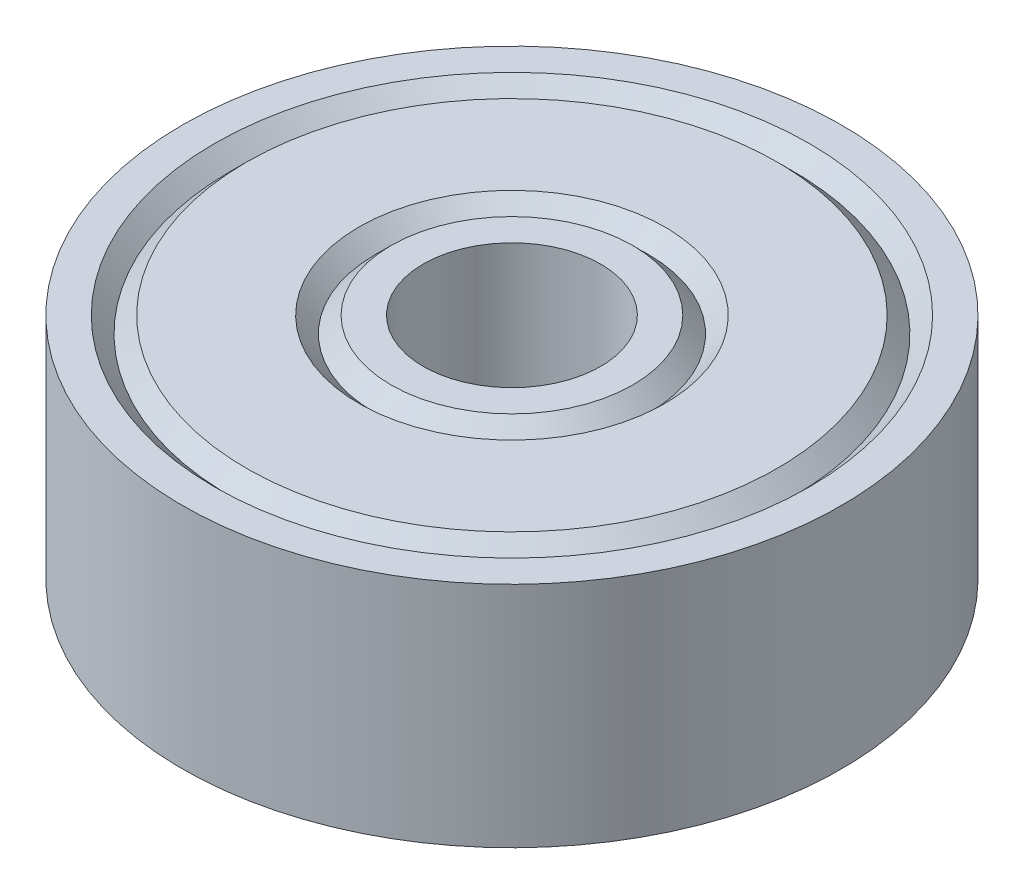
from build123d import *


with BuildPart() as part:
    # Sketch1 → Revolve1 (revolve)
    with BuildSketch(Plane.XY):
        Polygon((-3.5, 4.5), (-4.766666667, 4.5), (-5.4, 3.866666667), (-6.033333333, 4.5), (-10.466666667, 4.5), (-11.1, 3.866666667), (-11.733333333, 4.5), (-13, 4.5), (-13, -4.5), (-11.733333333, -4.5), (-11.1, -3.866666667), (-10.466666667, -4.5), (-6.033333333, -4.5), (-5.4, -3.866666667), (-4.766666667, -4.5), (-3.5, -4.5), align=None)
    revolve(axis=Axis((0, 4.5, 0), (0, -1, 0)))


solid = part.part
